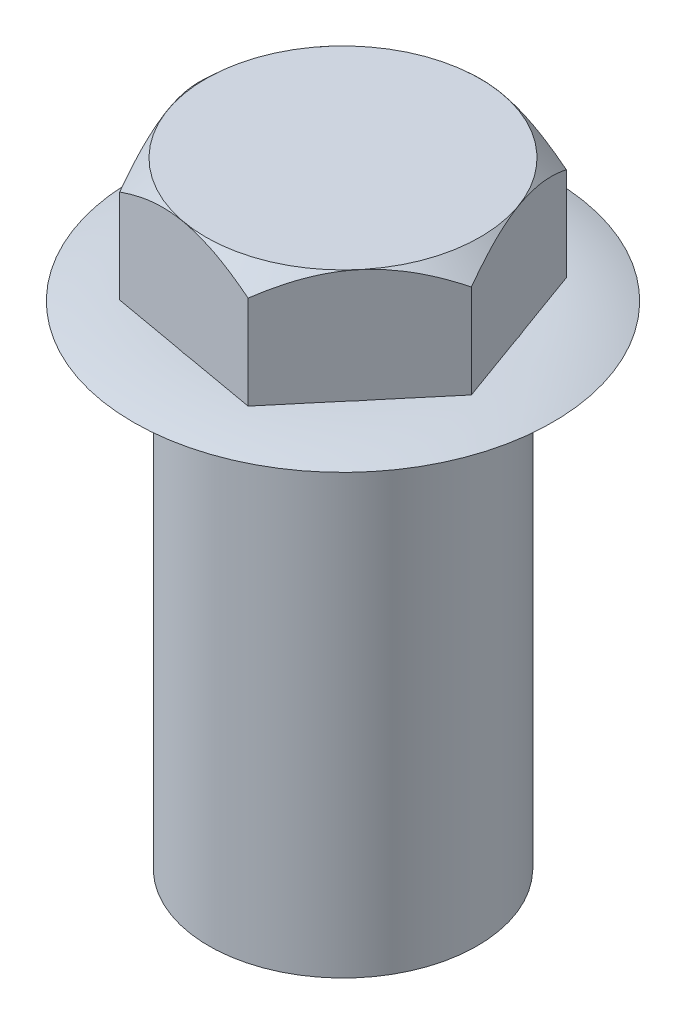
from build123d import *

# Parameters (mm, degrees)
BOSS_EXTRUDE1_DEPTH = 1.5


with BuildPart() as part:
    # Sketch1 → Revolve1 (revolve)
    with BuildSketch(Plane.XY, mode=Mode.PRIVATE) as revolve1_sk:
        with BuildLine():
            Line((0, 0), (1.775, 0))
            Line((1.775, 0), (1.775, 6.5))
            Line((1.775, 6.5), (2.775, 6.5))
            ThreePointArc((2.775, 6.5), (2.302554278, 6.609277193), (1.818611947, 6.640038943))
            Line((1.818611947, 6.640038943), (0, 6.640038943))
            Line((0, 6.640038943), (0, 0))
        make_face()
    revolve(revolve1_sk.sketch.rotate(Axis((0, 0, 0), (0, 1, 0)), 90), axis=Axis((0, 0, 0), (0, 1, 0)))

    # Sketch2 → Boss-Extrude1 (add)
    with BuildSketch(Plane(origin=(0, 6.640038943, 0), x_dir=(1, 0, 0), z_dir=(0, 1, 0))):
        Polygon((1.349267315, 1.604637118), (-0.71502285, 1.97081833), (-2.064290165, 0.366181213), (-1.349267315, -1.604637118), (0.71502285, -1.97081833), (2.064290165, -0.366181213), align=None)
    extrude(amount=BOSS_EXTRUDE1_DEPTH)

    # Sketch3 → Cut-Revolve1 (revolve, cut)
    with BuildSketch(Plane.XY, mode=Mode.PRIVATE) as cut_revolve1_sk:
        Polygon((1.11158303, 8.796006759), (2.422382115, 7.573543033), (2.422382115, 8.796006759), align=None)
    revolve(cut_revolve1_sk.sketch.rotate(Axis((0, 0, 0), (0, 1, 0)), 90), axis=Axis((0, 0, 0), (0, 1, 0)), mode=Mode.SUBTRACT)


solid = part.part
